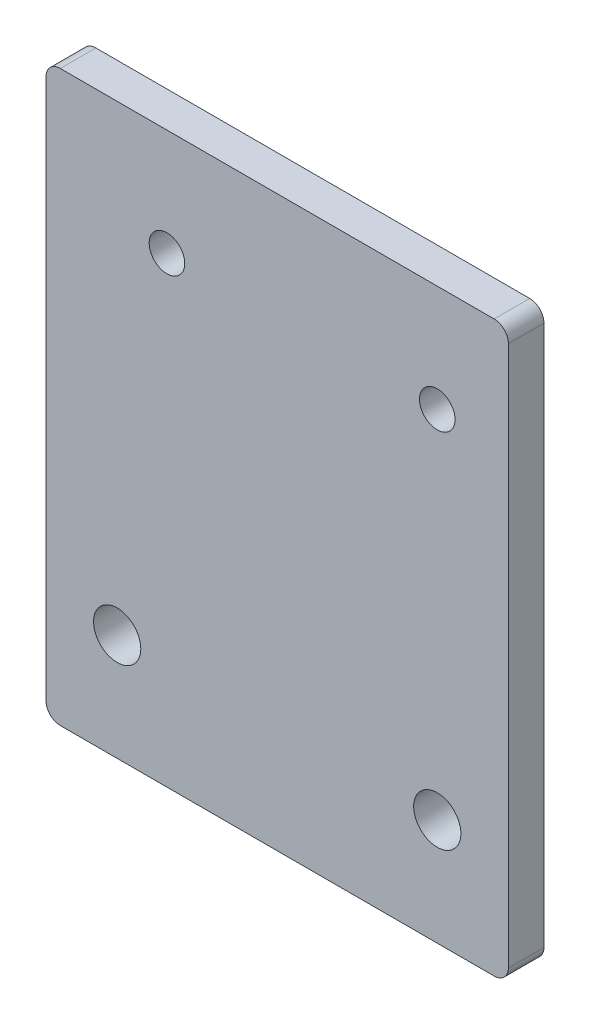
from build123d import *

# Parameters (mm, degrees)
SKETCH1_W           = 82.55
SKETCH1_H           = 101.6
BOSS_EXTRUDE1_DEPTH = 3.175
SKETCH2_R           = 3.175
SKETCH2_R_2         = 4.2164
CUT_EXTRUDE1_DEPTH  = 66.761600688
FILLET1_R           = 2.54


with BuildPart() as part:
    # Sketch1 → Boss-Extrude1 (new, symmetric)
    with BuildSketch(Plane.XY):
        Rectangle(SKETCH1_W, SKETCH1_H)
    extrude(amount=BOSS_EXTRUDE1_DEPTH, both=True)

    # Sketch2 → Cut-Extrude1 (cut, through all)
    with BuildSketch(Plane.XY.offset(3.175)):
        with Locations((-19.685, 31.75)):
            Circle(SKETCH2_R)
        with Locations((28.575, -31.75)):
            Circle(SKETCH2_R_2)
        with Locations((-28.575, -31.75)):
            Circle(SKETCH2_R_2)
        with Locations((28.575, 31.75)):
            Circle(SKETCH2_R)
    extrude(amount=-CUT_EXTRUDE1_DEPTH, mode=Mode.SUBTRACT)

    # Fillet1
    fillet1_edges = [part.edges().sort_by_distance(p)[0] for p in [
        (41.275, -50.8, 0),
        (-41.275, -50.8, 0),
        (-41.275, 50.8, 0),
        (41.275, 50.8, 0),
    ]]
    fillet(fillet1_edges, radius=FILLET1_R)


solid = part.part
